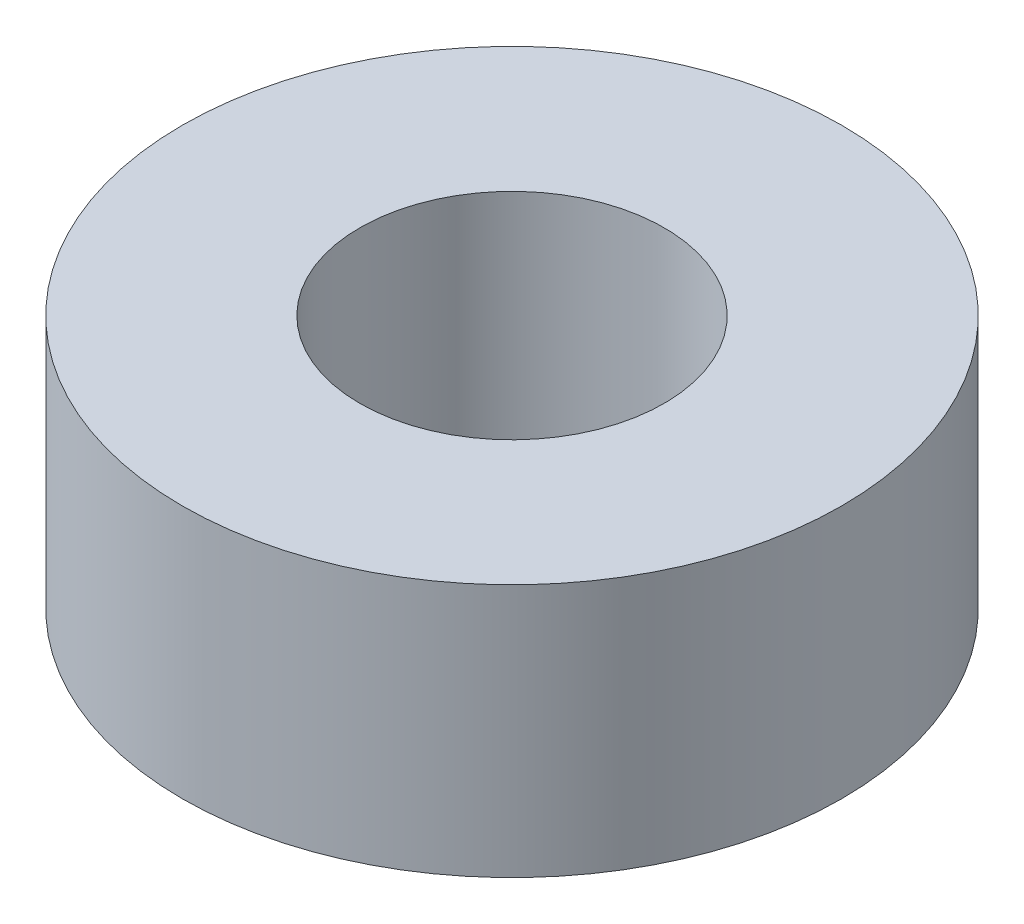
from build123d import *

# Parameters (mm, degrees)
SKETCH1_R           = 6.5
SKETCH1_R_2         = 3
BOSS_EXTRUDE1_DEPTH = 5


with BuildPart() as part:
    # Sketch1 → Boss-Extrude1 (new body)
    with BuildSketch(Plane(origin=(0, 0, 0), x_dir=(1, 0, 0), z_dir=(0, 1, 0))):
        with Locations(Location((0, 0, 0), (0, 0, 270))):
            Circle(SKETCH1_R)
        with Locations(Location((0, 0, 0), (0, 0, 270))):
            Circle(SKETCH1_R_2, mode=Mode.SUBTRACT)
    extrude(amount=BOSS_EXTRUDE1_DEPTH)


solid = part.part
